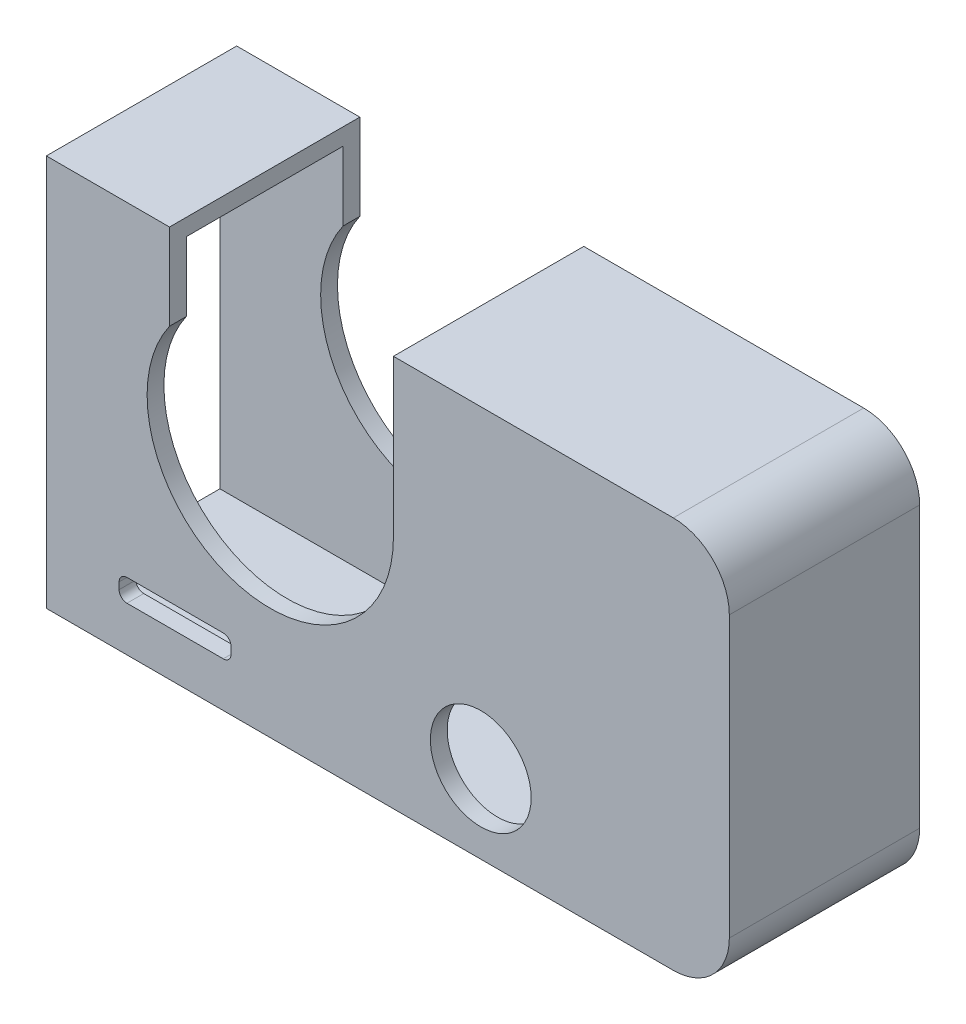
from build123d import *

# Parameters (mm, degrees)
BOSS_EXTRUDE2_DEPTH = 17
CUT_EXTRUDE1_DEPTH  = 14
CUT_EXTRUDE3_DEPTH  = 5
SKETCH9_W           = 14
SKETCH9_H           = 32
CUT_EXTRUDE4_DEPTH  = 11
SKETCH11_R          = 4.5
CUT_EXTRUDE5_DEPTH  = 10.5


with BuildPart() as part:
    # Sketch1 → Boss-Extrude2 (new body)
    with BuildSketch(Plane.XY):
        with BuildLine():
            Line((61, 5), (61, 30))
            ThreePointArc((61, 30), (59.535533906, 33.535533906), (56, 35))
            Line((56, 35), (31, 35))
            Line((31, 35), (31, 21))
            ThreePointArc((31, 21), (16.68337521, 10.511911518), (11, 27.32455532))
            Line((11, 27.32455532), (11, 35))
            Line((11, 35), (0, 35))
            Line((0, 35), (0, 0))
            Line((0, 0), (56, 0))
            ThreePointArc((56, 0), (59.535533906, 1.464466094), (61, 5))
        make_face()
    extrude(amount=BOSS_EXTRUDE2_DEPTH)

    # Sketch5 → Cut-Extrude1 (cut)
    with BuildSketch(Plane(origin=(0, 0, 1.5), x_dir=(-1, 0, 0), z_dir=(0, 0, -1))):
        with BuildLine():
            Line((-54.5, 33.5), (-1.5, 33.5))
            Line((-1.5, 33.5), (-1.5, 1.5))
            Line((-1.5, 1.5), (-54.5, 1.5))
            ThreePointArc((-54.5, 1.5), (-58.035533906, 2.964466094), (-59.5, 6.5))
            Line((-59.5, 6.5), (-59.5, 28.5))
            ThreePointArc((-59.5, 28.5), (-58.035533906, 32.035533906), (-54.5, 33.5))
        make_face()
    extrude(amount=-CUT_EXTRUDE1_DEPTH, mode=Mode.SUBTRACT)

    # Sketch10 → Cut-Extrude3 (cut)
    with BuildSketch(Plane.XY.offset(17)):
        with BuildLine():
            Line((7.2, 4), (15.8, 4))
            ThreePointArc((15.8, 4), (16.294974747, 4.205025253), (16.5, 4.7))
            Line((16.5, 4.7), (16.5, 5.3))
            ThreePointArc((16.5, 5.3), (16.294974747, 5.794974747), (15.8, 6))
            Line((15.8, 6), (7.2, 6))
            ThreePointArc((7.2, 6), (6.705025253, 5.794974747), (6.5, 5.3))
            Line((6.5, 5.3), (6.5, 4.7))
            ThreePointArc((6.5, 4.7), (6.705025253, 4.205025253), (7.2, 4))
        make_face()
    extrude(amount=-CUT_EXTRUDE3_DEPTH, mode=Mode.SUBTRACT)

    # Sketch9 → Cut-Extrude4 (cut)
    with BuildSketch(Plane.ZY):
        with Locations((8.5, 17.5)):
            Rectangle(SKETCH9_W, SKETCH9_H)
    extrude(amount=-CUT_EXTRUDE4_DEPTH, mode=Mode.SUBTRACT)

    # Sketch11 → Cut-Extrude5 (cut)
    with BuildSketch(Plane.XY.offset(17)):
        with Locations((38.8, 7)):
            Circle(SKETCH11_R)
    extrude(amount=-CUT_EXTRUDE5_DEPTH, mode=Mode.SUBTRACT)


solid = part.part
